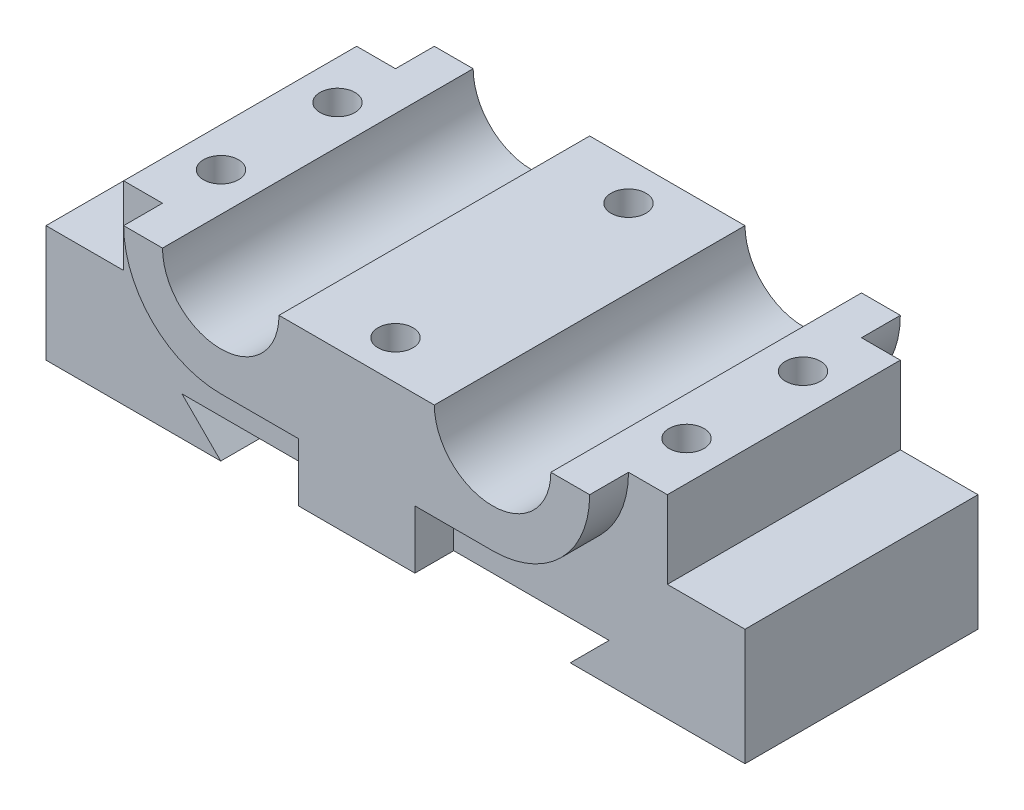
from build123d import *

# Parameters (mm, degrees)
BOSS_EXTRUDE1_DEPTH      = 15
BOSS_EXTRUDE1_DEPTH_BACK = 15
BOSS_EXTRUDE2_DEPTH      = 5
BOSS_EXTRUDE3_START      = 5
BOSS_EXTRUDE3_DEPTH      = 5
SKETCH5_R                = 2.25
CUT_EXTRUDE1_DEPTH       = 15


with BuildPart() as part:
    # Sketch1 → Boss-Extrude1 (new, two sides: drawn at the far end of the back side and taken through both)
    with BuildSketch(Plane.XY.offset(-BOSS_EXTRUDE1_DEPTH_BACK)):
        with BuildLine():
            Line((10, 9.334893048), (-10, 9.334893048))
            ThreePointArc((-10, 9.334893048), (-17.5, 1.834893048), (-25, 9.334893048))
            Line((-25, 9.334893048), (-35, 9.334893048))
            Line((-35, 9.334893048), (-35, -0.665106952))
            Line((-35, -0.665106952), (-45, -0.665106952))
            Line((-45, -0.665106952), (-45, -15.665106952))
            Line((-45, -15.665106952), (-22.5, -15.665106952))
            Line((-22.5, -15.665106952), (-27.5, -10.665106952))
            Line((-27.5, -10.665106952), (27.5, -10.665106952))
            Line((27.5, -10.665106952), (22.5, -15.665106952))
            Line((22.5, -15.665106952), (45, -15.665106952))
            Line((45, -15.665106952), (45, -0.665106952))
            Line((45, -0.665106952), (35, -0.665106952))
            Line((35, -0.665106952), (35, 9.334893048))
            Line((35, 9.334893048), (25, 9.334893048))
            ThreePointArc((25, 9.334893048), (17.5, 1.834893048), (10, 9.334893048))
        make_face()
    extrude(amount=BOSS_EXTRUDE1_DEPTH + BOSS_EXTRUDE1_DEPTH_BACK)

    # Sketch2 → Boss-Extrude2 (add)
    with BuildSketch(Plane.XY.offset(15)):
        with BuildLine():
            Line((-25, 9.334893048), (-30, 9.334893048))
            ThreePointArc((-30, 9.334893048), (-26.338834765, 0.496058283), (-17.5, -3.165106952))
            Line((-17.5, -3.165106952), (-7.5, -3.165106952))
            Line((-7.5, -3.165106952), (-7.5, -10.665106952))
            Line((-7.5, -10.665106952), (7.5, -10.665106952))
            Line((7.5, -10.665106952), (7.5, -3.165106952))
            Line((7.5, -3.165106952), (17.5, -3.165106952))
            ThreePointArc((17.5, -3.165106952), (26.338834765, 0.496058283), (30, 9.334893048))
            Line((30, 9.334893048), (25, 9.334893048))
            ThreePointArc((25, 9.334893048), (17.5, 1.834893048), (10, 9.334893048))
            Line((10, 9.334893048), (-10, 9.334893048))
            ThreePointArc((-10, 9.334893048), (-17.5, 1.834893048), (-25, 9.334893048))
        make_face()
    extrude(amount=BOSS_EXTRUDE2_DEPTH)

    # Sketch4 → Boss-Extrude3 (add)
    with BuildSketch(Plane(origin=(0, 0, -15), x_dir=(-1, 0, 0), z_dir=(0, 0, -1)).offset(BOSS_EXTRUDE3_START)):
        with BuildLine():
            Line((-10, 9.334893048), (10, 9.334893048))
            ThreePointArc((10, 9.334893048), (17.5, 1.834893048), (25, 9.334893048))
            Line((25, 9.334893048), (30, 9.334893048))
            ThreePointArc((30, 9.334893048), (26.338834765, 0.496058283), (17.5, -3.165106952))
            Line((17.5, -3.165106952), (7.467911319, -3.165106952))
            Line((7.467911319, -3.165106952), (7.5, -10.665106952))
            Line((7.5, -10.665106952), (-7.5, -10.665106952))
            Line((-7.5, -10.665106952), (-7.467911319, -3.165106952))
            Line((-7.467911319, -3.165106952), (-17.5, -3.165106952))
            ThreePointArc((-17.5, -3.165106952), (-26.338834765, 0.496058283), (-30, 9.334893048))
            Line((-30, 9.334893048), (-25, 9.334893048))
            ThreePointArc((-25, 9.334893048), (-17.5, 1.834893048), (-10, 9.334893048))
        make_face()
    extrude(amount=-BOSS_EXTRUDE3_DEPTH)

    # Sketch5 → Cut-Extrude1 (cut)
    with BuildSketch(Plane(origin=(0, 9.334893048, 0), x_dir=(1, 0, 0), z_dir=(0, 1, 0))):
        with Locations((0, -15)):
            Circle(SKETCH5_R)
        with Locations((-29.968631135, -7.5)):
            Circle(SKETCH5_R)
        with Locations((29.968631135, -7.5)):
            Circle(SKETCH5_R)
        with Locations((29.968631135, 7.5)):
            Circle(SKETCH5_R)
        with Locations((-29.968631135, 7.5)):
            Circle(SKETCH5_R)
        with Locations((0, 15)):
            Circle(SKETCH5_R)
    extrude(amount=-CUT_EXTRUDE1_DEPTH, mode=Mode.SUBTRACT)


solid = part.part
